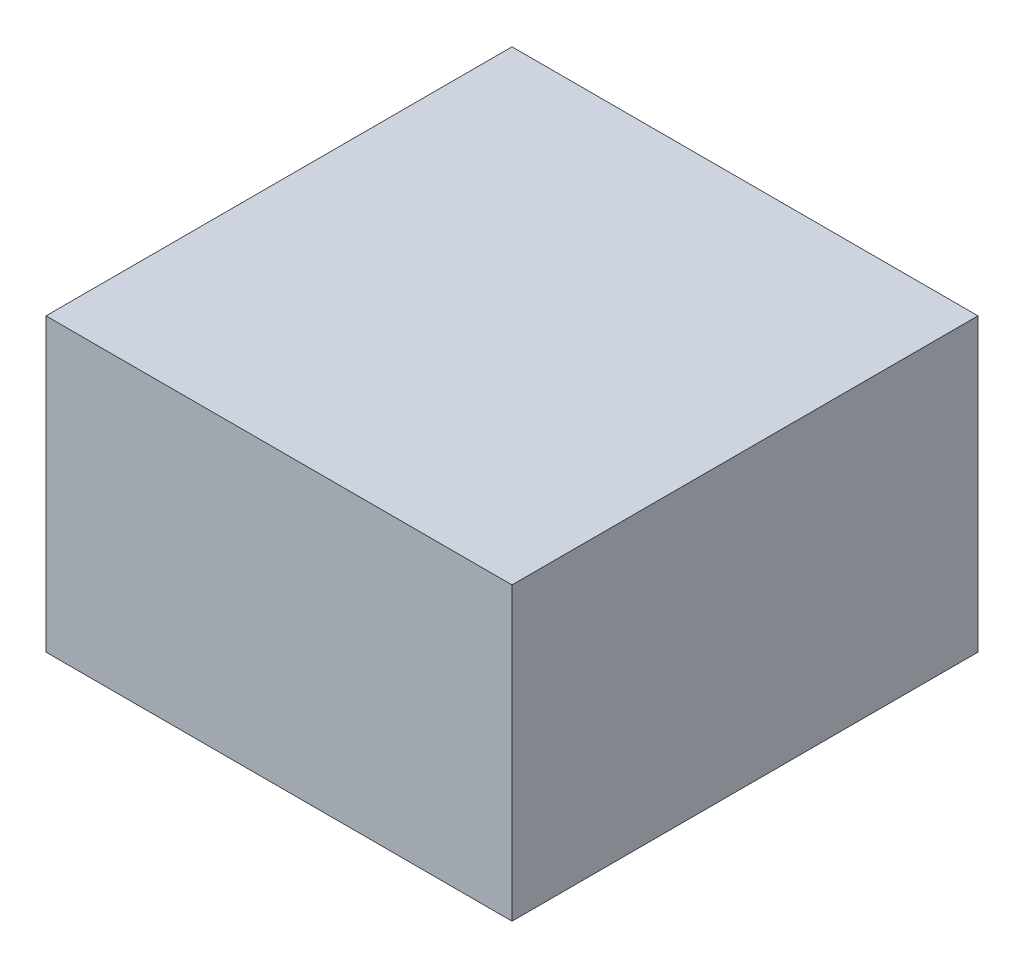
from build123d import *

# Parameters (mm, degrees)
SKETCH_1_W          = 40
SKETCH_1_H          = 25
CAMERA_MODULE_DEPTH = 40


with BuildPart() as part:
    # 草图1 → Camera_Module (new body)
    with BuildSketch(Plane.XY):
        with Locations((20, 12.5)):
            Rectangle(SKETCH_1_W, SKETCH_1_H)
    extrude(amount=CAMERA_MODULE_DEPTH)


solid = part.part
